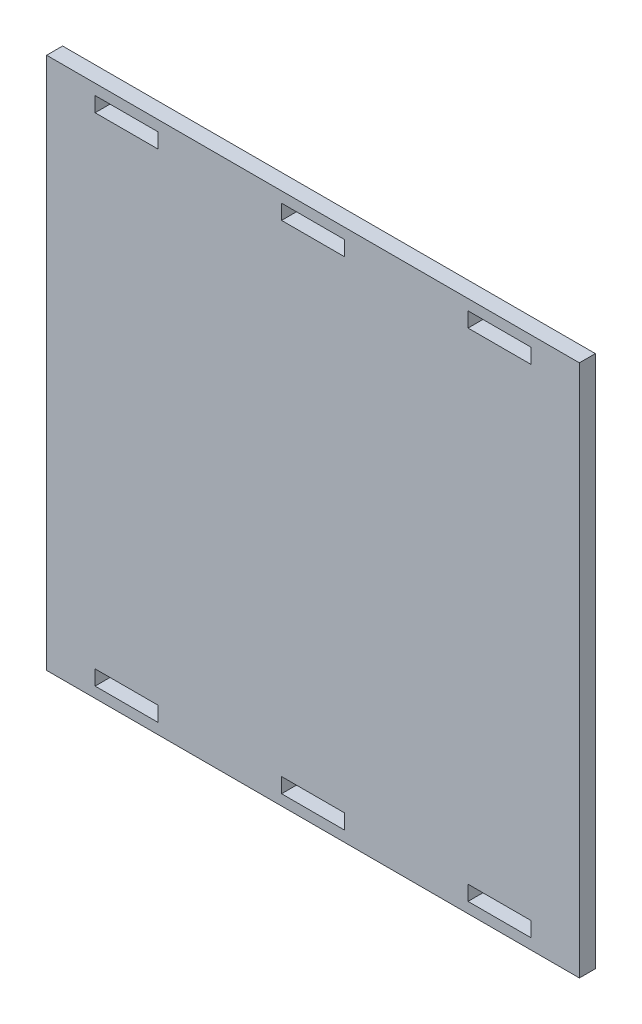
from build123d import *

# Parameters (mm, degrees)
SKETCH_1_W      = 100
SKETCH_1_H      = 100
SKETCH_1_W_2    = 11.8
SKETCH_1_H_2    = 2.8
EXTRUDE_1_DEPTH = 3


with BuildPart() as part:
    # Эскиз1 → Бобышка-Вытянуть1 (new body)
    with BuildSketch(Plane.XY):
        with Locations((50, 50)):
            Rectangle(SKETCH_1_W, SKETCH_1_H)
        with Locations((15, 3.4)):
            Rectangle(SKETCH_1_W_2, SKETCH_1_H_2, mode=Mode.SUBTRACT)
        with Locations((50, 3.4)):
            Rectangle(SKETCH_1_W_2, SKETCH_1_H_2, mode=Mode.SUBTRACT)
        with Locations((85, 3.4)):
            Rectangle(SKETCH_1_W_2, SKETCH_1_H_2, mode=Mode.SUBTRACT)
        with Locations((85, 96.6)):
            Rectangle(SKETCH_1_W_2, SKETCH_1_H_2, mode=Mode.SUBTRACT)
        with Locations((50, 96.6)):
            Rectangle(SKETCH_1_W_2, SKETCH_1_H_2, mode=Mode.SUBTRACT)
        with Locations((15, 96.6)):
            Rectangle(SKETCH_1_W_2, SKETCH_1_H_2, mode=Mode.SUBTRACT)
    extrude(amount=-EXTRUDE_1_DEPTH)


solid = part.part
